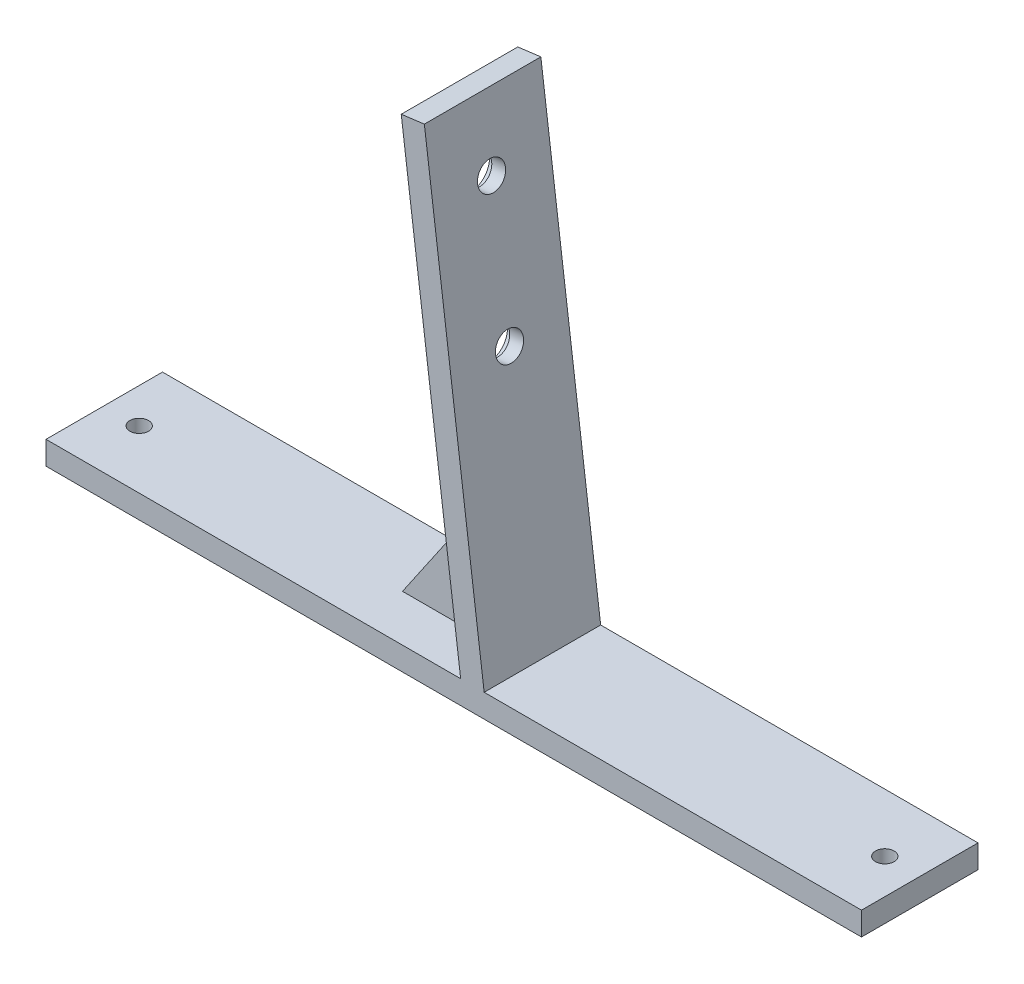
from build123d import *

# Parameters (mm, degrees)
SKETCH_1_W          = 350
SKETCH_1_H          = 50
SKETCH_1_R          = 4
EXTRUDE_1_DEPTH     = 10
EXTRUDE_2_DEPTH     = 50
CUT_EXTRUDE_1_DEPTH = 20
CUT_EXTRUDE_2_DEPTH = 20
SKETCH_5_R          = 6
CUT_EXTRUDE_3_DEPTH = 20
SKETCH_6_R          = 9
CUT_EXTRUDE_4_DEPTH = 4


with BuildPart() as part:
    # 草图1 → 凸台-拉伸1 (new body)
    with BuildSketch(Plane(origin=(0, 0, 0), x_dir=(1, 0, 0), z_dir=(0, 1, 0))):
        with Locations((175, 25)):
            Rectangle(SKETCH_1_W, SKETCH_1_H)
        with Locations(Location((15, 25, 0), (0, 0, 270))):
            Circle(SKETCH_1_R, mode=Mode.SUBTRACT)
        with Locations(Location((335, 25, 0), (0, 0, 90))):
            Circle(SKETCH_1_R, mode=Mode.SUBTRACT)
    extrude(amount=EXTRUDE_1_DEPTH)

    # 草图2 → 凸台-拉伸2 (add)
    with BuildSketch(Plane.XY):
        Polygon((170.81786786, 65.231720812), (152.463883228, 207.062743075), (162.381189023, 208.346115889), (188.0486453, 10), (175, 10), (133, 10), align=None)
    extrude(amount=-EXTRUDE_2_DEPTH)

    # 草图3 → 切除-拉伸1 (cut)
    with BuildSketch(Plane.XY):
        Polygon((177.96526156, 10), (133, 10), (170.81786786, 65.231720812), align=None)
    extrude(amount=-CUT_EXTRUDE_1_DEPTH, mode=Mode.SUBTRACT)

    # 草图4 → 切除-拉伸2 (cut)
    with BuildSketch(Plane(origin=(0, 0, -50), x_dir=(-1, 0, 0), z_dir=(0, 0, -1))):
        Polygon((-170.81786786, 65.231720812), (-177.96526156, 10), (-133, 10), align=None)
    extrude(amount=-CUT_EXTRUDE_2_DEPTH, mode=Mode.SUBTRACT)

    # 草图5 → 切除-拉伸3 (cut)
    with BuildSketch(Plane(origin=(186.224158089, 24.098785167, 0), x_dir=(0, 0, -1), z_dir=(0.9917305794448423, 0.12833728138774617, 0))):
        with Locations(Location((25, 95.783653888, 0), (0, 0, 90))):
            Circle(SKETCH_5_R)
        with Locations(Location((25, 155.783653888, 0), (0, 0, 90))):
            Circle(SKETCH_5_R)
    extrude(amount=-CUT_EXTRUDE_3_DEPTH, mode=Mode.SUBTRACT)

    # 草图6 → 切除-拉伸4 (cut)
    with BuildSketch(Plane(origin=(176.306852295, 22.815412353, 0), x_dir=(0, 0, 1), z_dir=(-0.9917305794448422, -0.1283372813877468, 0))):
        with Locations(Location((-25, 155.783653888, 0), (0, 0, 270))):
            Circle(SKETCH_6_R)
        with Locations(Location((-25, 95.783653888, 0), (0, 0, 270))):
            Circle(SKETCH_6_R)
    extrude(amount=-CUT_EXTRUDE_4_DEPTH, mode=Mode.SUBTRACT)


solid = part.part
